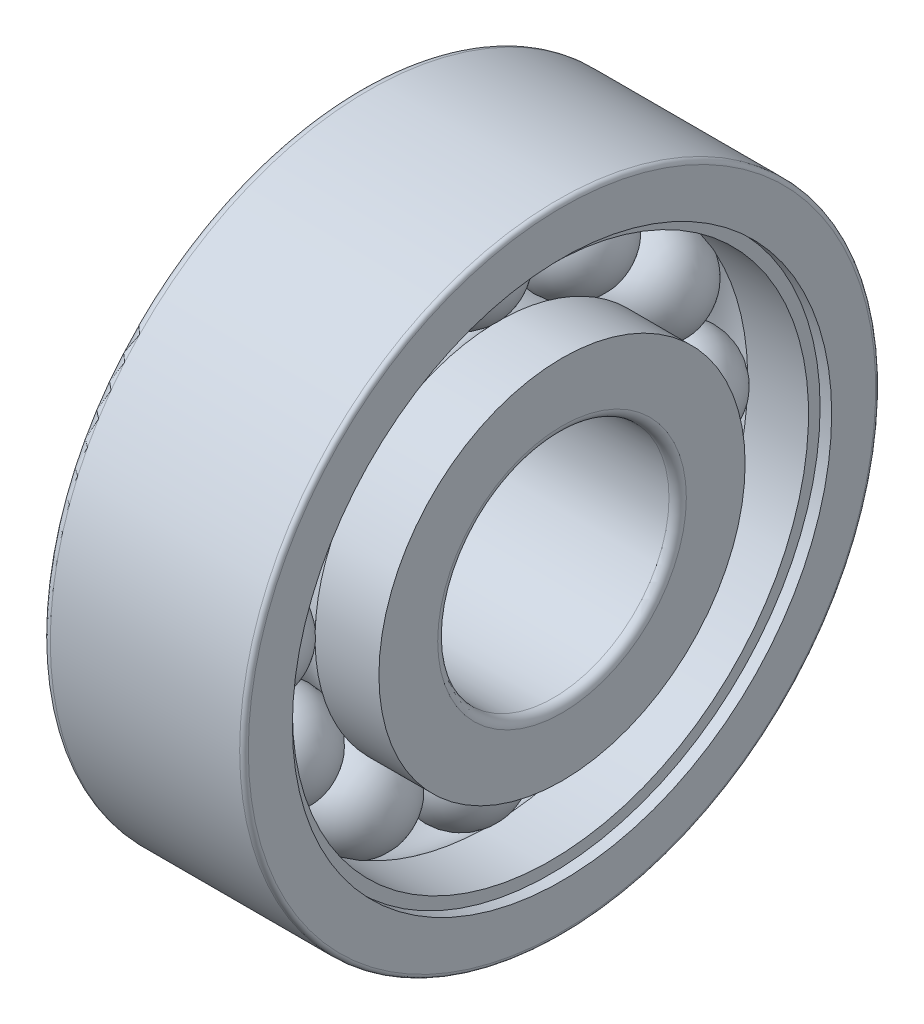
from build123d import *

# Parameters (mm, degrees)
CIRCULAR_PATTERN1_COUNT = 12
FILLET1_R               = 0.3
FILLET2_R               = 0.15


with BuildPart() as part:
    # Sketch1 → Revolve1 (revolve)
    with BuildSketch(Plane.XY):
        with BuildLine():
            Line((-1.75, 7.5), (1.75, 7.5))
            ThreePointArc((1.75, 7.5), (0, 5.75), (-1.75, 7.5))
        make_face()
    revolve1 = revolve(axis=Axis((-3.091912561, 7.5, 0), (1, 0, 0)))

    # Sketch2 → Revolve2 (revolve)
    with BuildSketch(Plane.XY, mode=Mode.PRIVATE) as revolve2_sk:
        with BuildLine():
            Line((-3.5, 6.333333333), (-1.290925594, 6.333333333))
            ThreePointArc((-1.290925594, 6.333333333), (0, 5.76), (1.290925594, 6.333333333))
            Line((1.290925594, 6.333333333), (3.5, 6.333333333))
            Line((3.5, 6.333333333), (3.5, 4))
            Line((3.5, 4), (-3.5, 4))
            Line((-3.5, 4), (-3.5, 6.333333333))
        make_face()
    revolve(revolve2_sk.sketch.rotate(Axis((-2.992358943, 0, 0), (1, 0, 0)), 90), axis=Axis((-2.992358943, 0, 0), (1, 0, 0)))

    # Sketch3 → Revolve3 (revolve)
    with BuildSketch(Plane.XY, mode=Mode.PRIVATE) as revolve3_sk:
        with BuildLine():
            Line((-3.5, 8.666666667), (-3.5, 11))
            Line((-3.5, 11), (3.5, 11))
            Line((3.5, 11), (3.5, 9.326666667))
            Line((3.5, 9.326666667), (3.1, 9.326666667))
            Line((3.1, 9.326666667), (3.1, 8.926666667))
            Line((3.1, 8.926666667), (0.99610352, 8.926666667))
            ThreePointArc((0.99610352, 8.926666667), (-0.196545195, 9.228863785), (-1.290925594, 8.666666667))
            Line((-1.290925594, 8.666666667), (-3.5, 8.666666667))
        make_face()
    revolve(revolve3_sk.sketch.rotate(Axis((-2.992358943, 0, 0), (1, 0, 0)), 90), axis=Axis((-2.992358943, 0, 0), (1, 0, 0)))

    # Circular-Pattern1: Revolve1 ×12 about axis
    circular_pattern1_axis = Axis((0, 0, 0), (1, 0, 0))
    for i in range(1, CIRCULAR_PATTERN1_COUNT):
        add(revolve1.rotate(circular_pattern1_axis, i * 360 / CIRCULAR_PATTERN1_COUNT))

    # Fillet1
    fillet1_edges = [part.edges().sort_by_distance(p)[0] for p in [
        (-3.5, 0, -11),
        (3.5, 0, -4),
    ]]
    fillet(fillet1_edges, radius=FILLET1_R)

    # Fillet2
    fillet2_edges = [part.edges().sort_by_distance(p)[0] for p in [
        (3.5, 0, -11),
        (-3.5, 0, -4),
    ]]
    fillet(fillet2_edges, radius=FILLET2_R)


solid = part.part
